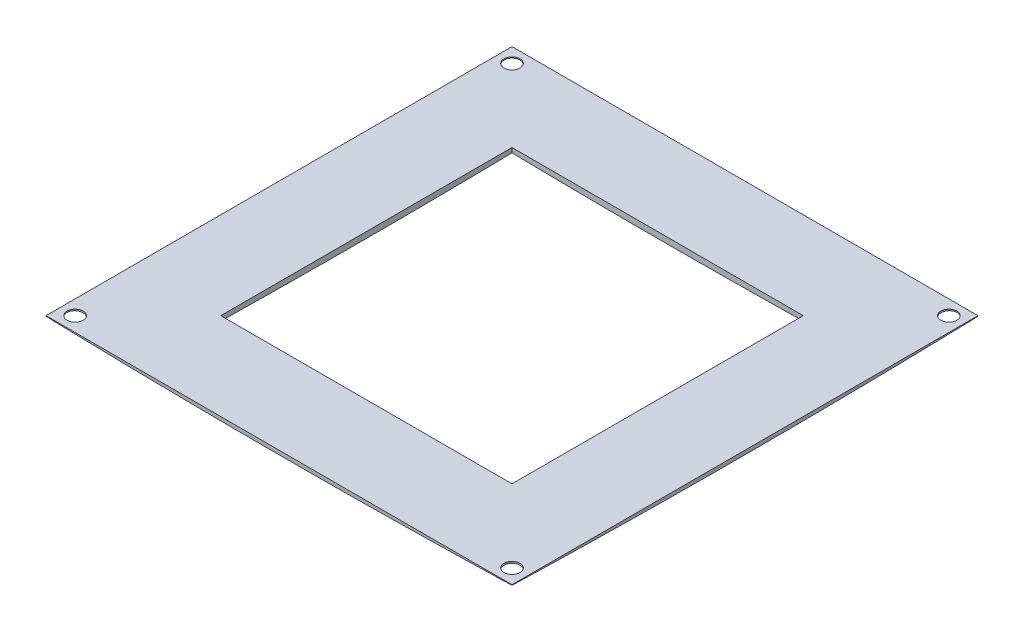
from build123d import *

# Parameters (mm, degrees)
SKETCH1_OUTSIDE_W   = 3521.15
SKETCH1_OUTSIDE_H   = 3521.15
SKETCH1_OUTSIDE_W_2 = 203.2
SKETCH1_OUTSIDE_H_2 = 203.2
CUT_EXTRUDE1_DEPTH  = 2190.743594482
CUT_EXTRUDE2_START  = 3.175
SKETCH5_W           = 234.523944536
SKETCH5_H           = 253.300586876
CUT_EXTRUDE2_DEPTH  = 1052.463791587
SKETCH6_R           = 3.4925
SKETCH6_W           = 127
SKETCH6_H           = 127
CUT_EXTRUDE3_DEPTH  = 144.719172925


with BuildPart() as part:
    # Sketch3 → Revolve1 (revolve)
    with BuildSketch(Plane(origin=(0, 0, 0), x_dir=(0, 0, -1), z_dir=(1, 0, 0))):
        with BuildLine():
            Line((0, 0), (0, 1044.805178237))
            add(Edge.make_bspline(
                [(0, 1044.805178237), (-1360.764334547, 1044.805178237), (-1360.764334547, 522.402589118), (-1360.764334547, 0), (0, 0)],
                knots=[1.570796327, 1.570796327, 1.570796327, 3.141592654, 3.141592654, 4.71238898, 4.71238898, 4.71238898], degree=2, weights=[1, 0.707106781, 1, 0.707106781, 1]))
        make_face()
    revolve(axis=Axis((0, 0, 0), (0, 1, 0)))

    # Sketch1 outside → Cut-Extrude1 (cut, through all)
    with BuildSketch(Plane(origin=(0, 0, 0), x_dir=(1, 0, 0), z_dir=(0, 1, 0))):
        Rectangle(SKETCH1_OUTSIDE_W, SKETCH1_OUTSIDE_H)
        Rectangle(SKETCH1_OUTSIDE_W_2, SKETCH1_OUTSIDE_H_2, mode=Mode.SUBTRACT)
    extrude(amount=CUT_EXTRUDE1_DEPTH, mode=Mode.SUBTRACT)

    # Sketch5 → Cut-Extrude2 (cut, through all)
    with BuildSketch(Plane(origin=(0, 0, 0), x_dir=(1, 0, 0), z_dir=(0, 1, 0)).offset(CUT_EXTRUDE2_START)):
        Rectangle(SKETCH5_W, SKETCH5_H)
    extrude(amount=CUT_EXTRUDE2_DEPTH, mode=Mode.SUBTRACT)

    # Sketch6 → Cut-Extrude3 (cut, through all)
    with BuildSketch(Plane(origin=(0, 3.175, 0), x_dir=(1, 0, 0), z_dir=(0, 1, 0))):
        with Locations(Location((-95.25, -95.25, 0), (0, 0, 270))):
            Circle(SKETCH6_R)
        with Locations(Location((-95.25, 95.25, 0), (0, 0, 270))):
            Circle(SKETCH6_R)
        with Locations(Location((95.25, 95.25, 0), (0, 0, 270))):
            Circle(SKETCH6_R)
        with Locations(Location((95.25, -95.25, 0), (0, 0, 270))):
            Circle(SKETCH6_R)
        Rectangle(SKETCH6_W, SKETCH6_H)
    extrude(amount=-CUT_EXTRUDE3_DEPTH, mode=Mode.SUBTRACT)


solid = part.part
